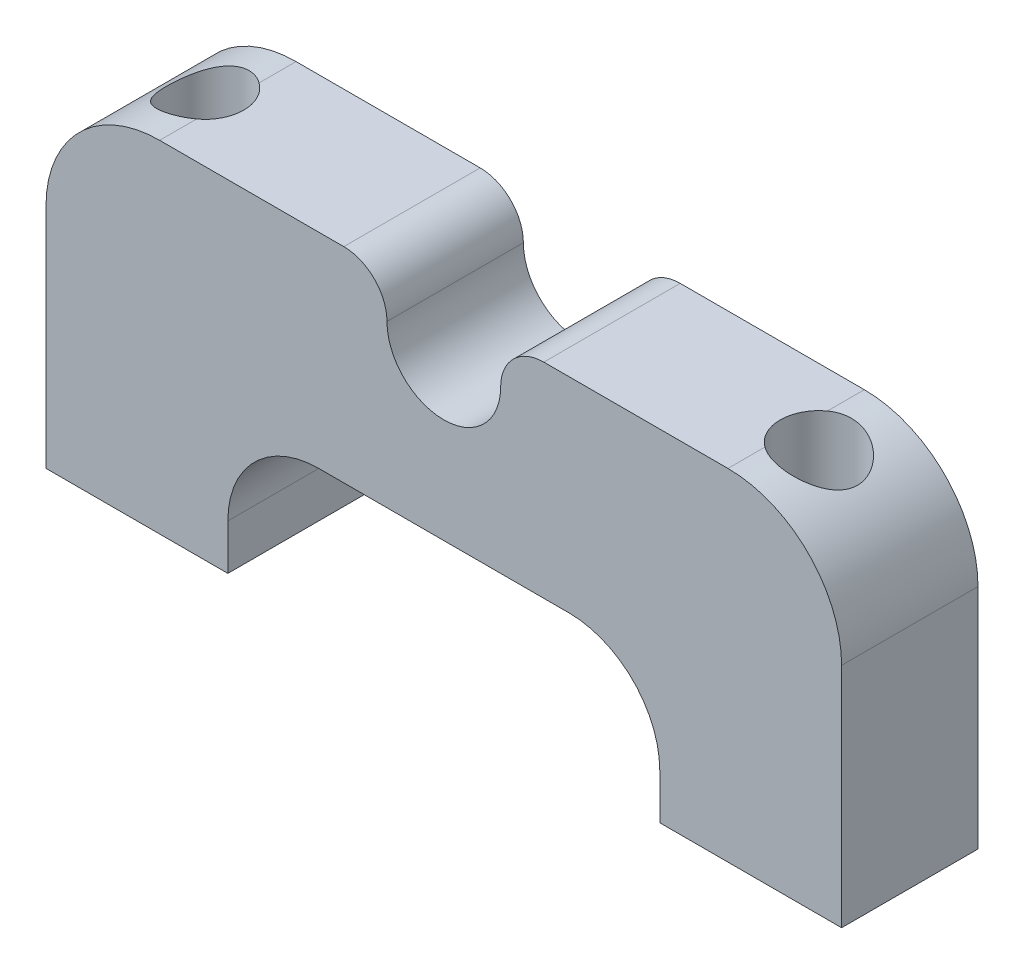
from build123d import *

# Parameters (mm, degrees)
BOSS_EXTRUDE1_DEPTH                                  = 3
CSK_FOR_M1_6_COUNTERSUNK_FLAT_HEAD_SCREW_D           = 1.7
CSK_FOR_M1_6_COUNTERSUNK_FLAT_HEAD_SCREW_CSINK_D     = 2
CSK_FOR_M1_6_COUNTERSUNK_FLAT_HEAD_SCREW_CSINK_ANGLE = 90


with BuildPart() as part:
    # Sketch1 → Boss-Extrude1 (new body)
    with BuildSketch(Plane.XY):
        with BuildLine():
            Line((8.75, -3.75), (4.75, -3.75))
            Line((4.75, -3.75), (4.75, -2.75))
            ThreePointArc((4.75, -2.75), (4.164213562, -1.335786438), (2.75, -0.75))
            Line((2.75, -0.75), (-2.75, -0.75))
            ThreePointArc((-2.75, -0.75), (-4.164213562, -1.335786438), (-4.75, -2.75))
            Line((-4.75, -2.75), (-4.75, -3.75))
            Line((-4.75, -3.75), (-8.75, -3.75))
            Line((-8.75, -3.75), (-8.75, 1.25))
            ThreePointArc((-8.75, 1.25), (-8.017766953, 3.017766953), (-6.25, 3.75))
            Line((-6.25, 3.75), (-2.2, 3.75))
            ThreePointArc((-2.2, 3.75), (-1.528248558, 3.471751442), (-1.25, 2.8))
            ThreePointArc((-1.25, 2.8), (0, 1.55), (1.25, 2.8))
            ThreePointArc((1.25, 2.8), (1.528248558, 3.471751442), (2.2, 3.75))
            Line((2.2, 3.75), (6.25, 3.75))
            ThreePointArc((6.25, 3.75), (8.017766953, 3.017766953), (8.75, 1.25))
            Line((8.75, 1.25), (8.75, -3.75))
        make_face()
    extrude(amount=BOSS_EXTRUDE1_DEPTH)

    # CSK for M1.6 Countersunk Flat Head Screw1 (through all)
    with Locations(Plane(origin=(0, -3.75, 0), x_dir=(-1, 0, 0), z_dir=(0, -1, 0))):
        with Locations((6.75, -1.5), (-6.75, -1.5)):
            CounterSinkHole(CSK_FOR_M1_6_COUNTERSUNK_FLAT_HEAD_SCREW_D / 2, CSK_FOR_M1_6_COUNTERSUNK_FLAT_HEAD_SCREW_CSINK_D / 2, counter_sink_angle=CSK_FOR_M1_6_COUNTERSUNK_FLAT_HEAD_SCREW_CSINK_ANGLE)


solid = part.part
